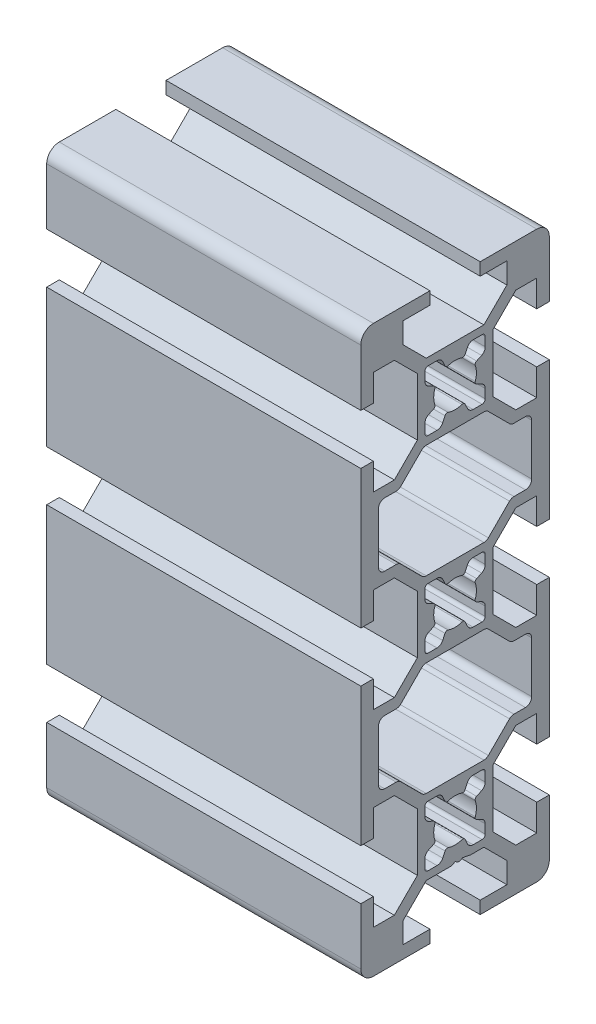
from build123d import *

# Parameters (mm, degrees)
BOSS_EXTRUDE1_DEPTH = 50


with BuildPart() as part:
    # Sketch1 → Boss-Extrude1 (new body)
    with BuildSketch(Plane(origin=(0, 0, 0), x_dir=(0, 0, -1), z_dir=(1, 0, 0))):
        with BuildLine():
            Line((-15, -34), (-15, -43))
            ThreePointArc((-15, -43), (-14.414213562, -44.414213562), (-13, -45))
            Line((-13, -45), (-4, -45))
            Line((-4, -45), (-4, -43))
            Line((-4, -43), (-8.25, -43))
            Line((-8.25, -43), (-8.25, -39.664213562))
            Line((-8.25, -39.664213562), (-4.585786438, -36))
            Line((-4.585786438, -36), (-0.653589838, -36))
            ThreePointArc((-0.653589838, -36), (-0.524180316, -35.982962913), (-0.403589838, -35.933012702))
            Line((-0.403589838, -35.933012702), (0, -35.7))
            Line((0, -35.7), (0.403589838, -35.933012702))
            ThreePointArc((0.403589838, -35.933012702), (0.653589838, -36), (0.903589838, -35.933012702))
            Line((0.903589838, -35.933012702), (1.218885629, -35.750976592))
            Line((1.218885629, -35.750976592), (2.5, -36))
            Line((2.5, -36), (4.585786438, -36))
            Line((4.585786438, -36), (8.25, -39.664213562))
            Line((8.25, -39.664213562), (8.25, -43))
            Line((8.25, -43), (4, -43))
            Line((4, -43), (4, -45))
            Line((4, -45), (13, -45))
            ThreePointArc((13, -45), (14.414213562, -44.414213562), (15, -43))
            Line((15, -43), (15, -34))
            Line((15, -34), (13, -34))
            Line((13, -34), (13, -38.25))
            Line((13, -38.25), (9.664213562, -38.25))
            Line((9.664213562, -38.25), (6, -34.585786438))
            Line((6, -34.585786438), (6, -25.414213562))
            Line((6, -25.414213562), (9.664213562, -21.75))
            Line((9.664213562, -21.75), (13, -21.75))
            Line((13, -21.75), (13, -26))
            Line((13, -26), (15, -26))
            Line((15, -26), (15, -4))
            Line((15, -4), (13, -4))
            Line((13, -4), (13, -8.25))
            Line((13, -8.25), (9.664213562, -8.25))
            Line((9.664213562, -8.25), (6, -4.585786438))
            Line((6, -4.585786438), (6, 4.585786438))
            Line((6, 4.585786438), (9.664213562, 8.25))
            Line((9.664213562, 8.25), (13, 8.25))
            Line((13, 8.25), (13, 4))
            Line((13, 4), (15, 4))
            Line((15, 4), (15, 26))
            Line((15, 26), (13, 26))
            Line((13, 26), (13, 21.75))
            Line((13, 21.75), (9.664213562, 21.75))
            Line((9.664213562, 21.75), (6, 25.414213562))
            Line((6, 25.414213562), (6, 34.585786438))
            Line((6, 34.585786438), (9.664213562, 38.25))
            Line((9.664213562, 38.25), (13, 38.25))
            Line((13, 38.25), (13, 34))
            Line((13, 34), (15, 34))
            Line((15, 34), (15, 43))
            ThreePointArc((15, 43), (14.414213562, 44.414213562), (13, 45))
            Line((13, 45), (4, 45))
            Line((4, 45), (4, 43))
            Line((4, 43), (8.25, 43))
            Line((8.25, 43), (8.25, 39.664213562))
            Line((8.25, 39.664213562), (4.585786438, 36))
            Line((4.585786438, 36), (-4.585786438, 36))
            Line((-4.585786438, 36), (-8.25, 39.664213562))
            Line((-8.25, 39.664213562), (-8.25, 43))
            Line((-8.25, 43), (-4, 43))
            Line((-4, 43), (-4, 45))
            Line((-4, 45), (-13, 45))
            ThreePointArc((-13, 45), (-14.414213562, 44.414213562), (-15, 43))
            Line((-15, 43), (-15, 34))
            Line((-15, 34), (-13, 34))
            Line((-13, 34), (-13, 38.25))
            Line((-13, 38.25), (-9.664213562, 38.25))
            Line((-9.664213562, 38.25), (-6, 34.585786438))
            Line((-6, 34.585786438), (-6, 25.414213562))
            Line((-6, 25.414213562), (-9.664213562, 21.75))
            Line((-9.664213562, 21.75), (-13, 21.75))
            Line((-13, 21.75), (-13, 26))
            Line((-13, 26), (-15, 26))
            Line((-15, 26), (-15, 4))
            Line((-15, 4), (-13, 4))
            Line((-13, 4), (-13, 8.25))
            Line((-13, 8.25), (-9.664213562, 8.25))
            Line((-9.664213562, 8.25), (-6, 4.585786438))
            Line((-6, 4.585786438), (-6, -4.585786438))
            Line((-6, -4.585786438), (-9.664213562, -8.25))
            Line((-9.664213562, -8.25), (-13, -8.25))
            Line((-13, -8.25), (-13, -4))
            Line((-13, -4), (-15, -4))
            Line((-15, -4), (-15, -26))
            Line((-15, -26), (-13, -26))
            Line((-13, -26), (-13, -21.75))
            Line((-13, -21.75), (-9.664213562, -21.75))
            Line((-9.664213562, -21.75), (-6, -25.414213562))
            Line((-6, -25.414213562), (-6, -34.585786438))
            Line((-6, -34.585786438), (-9.664213562, -38.25))
            Line((-9.664213562, -38.25), (-13, -38.25))
            Line((-13, -38.25), (-13, -34))
            Line((-13, -34), (-15, -34))
        make_face()
        with BuildLine():
            Line((-9.367193001, 20.05), (-11.2, 20.05))
            ThreePointArc((-11.2, 20.05), (-11.907106781, 19.757106781), (-12.2, 19.05))
            Line((-12.2, 19.05), (-12.2, 10.95))
            ThreePointArc((-12.2, 10.95), (-11.907106781, 10.242893219), (-11.2, 9.95))
            Line((-11.2, 9.95), (-9.367193001, 9.95))
            ThreePointArc((-9.367193001, 9.95), (-8.984509569, 9.873879533), (-8.66008622, 9.657106781))
            Line((-8.66008622, 9.657106781), (-5.295872657, 6.292893219))
            ThreePointArc((-5.295872657, 6.292893219), (-4.971449309, 6.076120467), (-4.588765876, 6))
            Line((-4.588765876, 6), (4.595836944, 6))
            ThreePointArc((4.595836944, 6), (4.978520376, 6.076120467), (5.302943725, 6.292893219))
            Line((5.302943725, 6.292893219), (8.667157288, 9.657106781))
            ThreePointArc((8.667157288, 9.657106781), (8.991580636, 9.873879533), (9.374264069, 9.95))
            Line((9.374264069, 9.95), (11.2, 9.95))
            ThreePointArc((11.2, 9.95), (11.907106781, 10.242893219), (12.2, 10.95))
            Line((12.2, 10.95), (12.2, 19.05))
            ThreePointArc((12.2, 19.05), (11.907106781, 19.757106781), (11.2, 20.05))
            Line((11.2, 20.05), (9.374264069, 20.05))
            ThreePointArc((9.374264069, 20.05), (8.991580636, 20.126120467), (8.667157288, 20.342893219))
            Line((8.667157288, 20.342893219), (5.302943725, 23.707106781))
            ThreePointArc((5.302943725, 23.707106781), (4.978520376, 23.923879533), (4.595836944, 24))
            Line((4.595836944, 24), (-4.588765876, 24))
            ThreePointArc((-4.588765876, 24), (-4.971449309, 23.923879533), (-5.295872657, 23.707106781))
            Line((-5.295872657, 23.707106781), (-8.66008622, 20.342893219))
            ThreePointArc((-8.66008622, 20.342893219), (-8.984509569, 20.126120467), (-9.367193001, 20.05))
        make_face(mode=Mode.SUBTRACT)
        with BuildLine():
            Line((1.969039233, 34.222618262), (1.597027384, 33.424836278))
            ThreePointArc((1.597027384, 33.424836278), (1.390932719, 33.225739399), (1.104556452, 33.215580048))
            ThreePointArc((1.104556452, 33.215580048), (0, 33.4), (-1.104556452, 33.215580048))
            ThreePointArc((-1.104556452, 33.215580048), (-1.390932719, 33.225739399), (-1.597027384, 33.424836278))
            Line((-1.597027384, 33.424836278), (-1.969039233, 34.222618262))
            ThreePointArc((-1.969039233, 34.222618262), (-2.338047412, 34.643391446), (-2.87534702, 34.8))
            Line((-2.87534702, 34.8), (-4.3, 34.8))
            ThreePointArc((-4.3, 34.8), (-4.653553391, 34.653553391), (-4.8, 34.3))
            Line((-4.8, 34.3), (-4.8, 32.87534702))
            ThreePointArc((-4.8, 32.87534702), (-4.643391446, 32.338047412), (-4.222618262, 31.969039233))
            Line((-4.222618262, 31.969039233), (-3.424836278, 31.597027384))
            ThreePointArc((-3.424836278, 31.597027384), (-3.225739399, 31.390932719), (-3.215580048, 31.104556452))
            ThreePointArc((-3.215580048, 31.104556452), (-3.4, 30), (-3.215580048, 28.895443548))
            ThreePointArc((-3.215580048, 28.895443548), (-3.225739399, 28.609067281), (-3.424836278, 28.402972616))
            Line((-3.424836278, 28.402972616), (-4.222618262, 28.030960767))
            ThreePointArc((-4.222618262, 28.030960767), (-4.643391446, 27.661952588), (-4.8, 27.12465298))
            Line((-4.8, 27.12465298), (-4.8, 25.7))
            ThreePointArc((-4.8, 25.7), (-4.653553391, 25.346446609), (-4.3, 25.2))
            Line((-4.3, 25.2), (-2.87534702, 25.2))
            ThreePointArc((-2.87534702, 25.2), (-2.338047412, 25.356608554), (-1.969039233, 25.777381738))
            Line((-1.969039233, 25.777381738), (-1.597027384, 26.575163722))
            ThreePointArc((-1.597027384, 26.575163722), (-1.390932719, 26.774260601), (-1.104556452, 26.784419952))
            ThreePointArc((-1.104556452, 26.784419952), (0, 26.6), (1.104556452, 26.784419952))
            ThreePointArc((1.104556452, 26.784419952), (1.390932719, 26.774260601), (1.597027384, 26.575163722))
            Line((1.597027384, 26.575163722), (1.969039233, 25.777381738))
            ThreePointArc((1.969039233, 25.777381738), (2.338047412, 25.356608554), (2.87534702, 25.2))
            Line((2.87534702, 25.2), (4.3, 25.2))
            ThreePointArc((4.3, 25.2), (4.653553391, 25.346446609), (4.8, 25.7))
            Line((4.8, 25.7), (4.8, 27.12465298))
            ThreePointArc((4.8, 27.12465298), (4.643391446, 27.661952588), (4.222618262, 28.030960767))
            Line((4.222618262, 28.030960767), (3.424836278, 28.402972616))
            ThreePointArc((3.424836278, 28.402972616), (3.225739399, 28.609067281), (3.215580048, 28.895443548))
            ThreePointArc((3.215580048, 28.895443548), (3.4, 30), (3.215580048, 31.104556452))
            ThreePointArc((3.215580048, 31.104556452), (3.225739399, 31.390932719), (3.424836278, 31.597027384))
            Line((3.424836278, 31.597027384), (4.222618262, 31.969039233))
            ThreePointArc((4.222618262, 31.969039233), (4.643391446, 32.338047412), (4.8, 32.87534702))
            Line((4.8, 32.87534702), (4.8, 34.3))
            ThreePointArc((4.8, 34.3), (4.653553391, 34.653553391), (4.3, 34.8))
            Line((4.3, 34.8), (2.87534702, 34.8))
            ThreePointArc((2.87534702, 34.8), (2.338047412, 34.643391446), (1.969039233, 34.222618262))
        make_face(mode=Mode.SUBTRACT)
        with BuildLine():
            Line((4.3, 4.8), (2.87534702, 4.8))
            ThreePointArc((2.87534702, 4.8), (2.338047412, 4.643391446), (1.969039233, 4.222618262))
            Line((1.969039233, 4.222618262), (1.597027384, 3.424836278))
            ThreePointArc((1.597027384, 3.424836278), (1.390932719, 3.225739399), (1.104556452, 3.215580048))
            ThreePointArc((1.104556452, 3.215580048), (0, 3.4), (-1.104556452, 3.215580048))
            ThreePointArc((-1.104556452, 3.215580048), (-1.390932719, 3.225739399), (-1.597027384, 3.424836278))
            Line((-1.597027384, 3.424836278), (-1.969039233, 4.222618262))
            ThreePointArc((-1.969039233, 4.222618262), (-2.338047412, 4.643391446), (-2.87534702, 4.8))
            Line((-2.87534702, 4.8), (-4.3, 4.8))
            ThreePointArc((-4.3, 4.8), (-4.653553391, 4.653553391), (-4.8, 4.3))
            Line((-4.8, 4.3), (-4.8, 2.87534702))
            ThreePointArc((-4.8, 2.87534702), (-4.643391446, 2.338047412), (-4.222618262, 1.969039233))
            Line((-4.222618262, 1.969039233), (-3.424836278, 1.597027384))
            ThreePointArc((-3.424836278, 1.597027384), (-3.225739399, 1.390932719), (-3.215580048, 1.104556452))
            ThreePointArc((-3.215580048, 1.104556452), (-3.4, 0), (-3.215580048, -1.104556452))
            ThreePointArc((-3.215580048, -1.104556452), (-3.225739399, -1.390932719), (-3.424836278, -1.597027384))
            Line((-3.424836278, -1.597027384), (-4.222618262, -1.969039233))
            ThreePointArc((-4.222618262, -1.969039233), (-4.643391446, -2.338047412), (-4.8, -2.87534702))
            Line((-4.8, -2.87534702), (-4.8, -4.3))
            ThreePointArc((-4.8, -4.3), (-4.653553391, -4.653553391), (-4.3, -4.8))
            Line((-4.3, -4.8), (-2.87534702, -4.8))
            ThreePointArc((-2.87534702, -4.8), (-2.338047412, -4.643391446), (-1.969039233, -4.222618262))
            Line((-1.969039233, -4.222618262), (-1.597027384, -3.424836278))
            ThreePointArc((-1.597027384, -3.424836278), (-1.390932719, -3.225739399), (-1.104556452, -3.215580048))
            ThreePointArc((-1.104556452, -3.215580048), (0, -3.4), (1.104556452, -3.215580048))
            ThreePointArc((1.104556452, -3.215580048), (1.390932719, -3.225739399), (1.597027384, -3.424836278))
            Line((1.597027384, -3.424836278), (1.969039233, -4.222618262))
            ThreePointArc((1.969039233, -4.222618262), (2.338047412, -4.643391446), (2.87534702, -4.8))
            Line((2.87534702, -4.8), (4.3, -4.8))
            ThreePointArc((4.3, -4.8), (4.653553391, -4.653553391), (4.8, -4.3))
            Line((4.8, -4.3), (4.8, -2.87534702))
            ThreePointArc((4.8, -2.87534702), (4.643391446, -2.338047412), (4.222618262, -1.969039233))
            Line((4.222618262, -1.969039233), (3.424836278, -1.597027384))
            ThreePointArc((3.424836278, -1.597027384), (3.225739399, -1.390932719), (3.215580048, -1.104556452))
            ThreePointArc((3.215580048, -1.104556452), (3.4, 0), (3.215580048, 1.104556452))
            ThreePointArc((3.215580048, 1.104556452), (3.225739399, 1.390932719), (3.424836278, 1.597027384))
            Line((3.424836278, 1.597027384), (4.222618262, 1.969039233))
            ThreePointArc((4.222618262, 1.969039233), (4.643391446, 2.338047412), (4.8, 2.87534702))
            Line((4.8, 2.87534702), (4.8, 4.3))
            ThreePointArc((4.8, 4.3), (4.653553391, 4.653553391), (4.3, 4.8))
        make_face(mode=Mode.SUBTRACT)
        with BuildLine():
            Line((-4.222618262, -28.030960767), (-3.424836278, -28.402972616))
            ThreePointArc((-3.424836278, -28.402972616), (-3.225739399, -28.609067281), (-3.215580048, -28.895443548))
            ThreePointArc((-3.215580048, -28.895443548), (-3.4, -30), (-3.215580048, -31.104556452))
            ThreePointArc((-3.215580048, -31.104556452), (-3.225739399, -31.390932719), (-3.424836278, -31.597027384))
            Line((-3.424836278, -31.597027384), (-4.222618262, -31.969039233))
            ThreePointArc((-4.222618262, -31.969039233), (-4.643391446, -32.338047412), (-4.8, -32.87534702))
            Line((-4.8, -32.87534702), (-4.8, -34.3))
            ThreePointArc((-4.8, -34.3), (-4.653553391, -34.653553391), (-4.3, -34.8))
            Line((-4.3, -34.8), (-2.87534702, -34.8))
            ThreePointArc((-2.87534702, -34.8), (-2.338047412, -34.643391446), (-1.969039233, -34.222618262))
            Line((-1.969039233, -34.222618262), (-1.597027384, -33.424836278))
            ThreePointArc((-1.597027384, -33.424836278), (-1.390932719, -33.225739399), (-1.104556452, -33.215580048))
            ThreePointArc((-1.104556452, -33.215580048), (0, -33.4), (1.104556452, -33.215580048))
            ThreePointArc((1.104556452, -33.215580048), (1.390932719, -33.225739399), (1.597027384, -33.424836278))
            Line((1.597027384, -33.424836278), (1.969039233, -34.222618262))
            ThreePointArc((1.969039233, -34.222618262), (2.338047412, -34.643391446), (2.87534702, -34.8))
            Line((2.87534702, -34.8), (4.3, -34.8))
            ThreePointArc((4.3, -34.8), (4.653553391, -34.653553391), (4.8, -34.3))
            Line((4.8, -34.3), (4.8, -32.87534702))
            ThreePointArc((4.8, -32.87534702), (4.643391446, -32.338047412), (4.222618262, -31.969039233))
            Line((4.222618262, -31.969039233), (3.424836278, -31.597027384))
            ThreePointArc((3.424836278, -31.597027384), (3.225739399, -31.390932719), (3.215580048, -31.104556452))
            ThreePointArc((3.215580048, -31.104556452), (3.4, -30), (3.215580048, -28.895443548))
            ThreePointArc((3.215580048, -28.895443548), (3.225739399, -28.609067281), (3.424836278, -28.402972616))
            Line((3.424836278, -28.402972616), (4.222618262, -28.030960767))
            ThreePointArc((4.222618262, -28.030960767), (4.643391446, -27.661952588), (4.8, -27.12465298))
            Line((4.8, -27.12465298), (4.8, -25.7))
            ThreePointArc((4.8, -25.7), (4.653553391, -25.346446609), (4.3, -25.2))
            Line((4.3, -25.2), (2.87534702, -25.2))
            ThreePointArc((2.87534702, -25.2), (2.338047412, -25.356608554), (1.969039233, -25.777381738))
            Line((1.969039233, -25.777381738), (1.597027384, -26.575163722))
            ThreePointArc((1.597027384, -26.575163722), (1.390932719, -26.774260601), (1.104556452, -26.784419952))
            ThreePointArc((1.104556452, -26.784419952), (0, -26.6), (-1.104556452, -26.784419952))
            ThreePointArc((-1.104556452, -26.784419952), (-1.390932719, -26.774260601), (-1.597027384, -26.575163722))
            Line((-1.597027384, -26.575163722), (-1.969039233, -25.777381738))
            ThreePointArc((-1.969039233, -25.777381738), (-2.338047412, -25.356608554), (-2.87534702, -25.2))
            Line((-2.87534702, -25.2), (-4.3, -25.2))
            ThreePointArc((-4.3, -25.2), (-4.653553391, -25.346446609), (-4.8, -25.7))
            Line((-4.8, -25.7), (-4.8, -27.12465298))
            ThreePointArc((-4.8, -27.12465298), (-4.643391446, -27.661952588), (-4.222618262, -28.030960767))
        make_face(mode=Mode.SUBTRACT)
        with BuildLine():
            Line((-9.367193001, -9.95), (-11.2, -9.95))
            ThreePointArc((-11.2, -9.95), (-11.907106781, -10.242893219), (-12.2, -10.95))
            Line((-12.2, -10.95), (-12.2, -19.05))
            ThreePointArc((-12.2, -19.05), (-11.907106781, -19.757106781), (-11.2, -20.05))
            Line((-11.2, -20.05), (-9.367193001, -20.05))
            ThreePointArc((-9.367193001, -20.05), (-8.984509569, -20.126120467), (-8.66008622, -20.342893219))
            Line((-8.66008622, -20.342893219), (-5.295872657, -23.707106781))
            ThreePointArc((-5.295872657, -23.707106781), (-4.971449309, -23.923879533), (-4.588765876, -24))
            Line((-4.588765876, -24), (4.595836944, -24))
            ThreePointArc((4.595836944, -24), (4.978520376, -23.923879533), (5.302943725, -23.707106781))
            Line((5.302943725, -23.707106781), (8.667157288, -20.342893219))
            ThreePointArc((8.667157288, -20.342893219), (8.991580636, -20.126120467), (9.374264069, -20.05))
            Line((9.374264069, -20.05), (11.2, -20.05))
            ThreePointArc((11.2, -20.05), (11.907106781, -19.757106781), (12.2, -19.05))
            Line((12.2, -19.05), (12.2, -10.95))
            ThreePointArc((12.2, -10.95), (11.907106781, -10.242893219), (11.2, -9.95))
            Line((11.2, -9.95), (9.374264069, -9.95))
            ThreePointArc((9.374264069, -9.95), (8.991580636, -9.873879533), (8.667157288, -9.657106781))
            Line((8.667157288, -9.657106781), (5.302943725, -6.292893219))
            ThreePointArc((5.302943725, -6.292893219), (4.978520376, -6.076120467), (4.595836944, -6))
            Line((4.595836944, -6), (-4.588765876, -6))
            ThreePointArc((-4.588765876, -6), (-4.971449309, -6.076120467), (-5.295872657, -6.292893219))
            Line((-5.295872657, -6.292893219), (-8.66008622, -9.657106781))
            ThreePointArc((-8.66008622, -9.657106781), (-8.984509569, -9.873879533), (-9.367193001, -9.95))
        make_face(mode=Mode.SUBTRACT)
    extrude(amount=BOSS_EXTRUDE1_DEPTH)


solid = part.part
